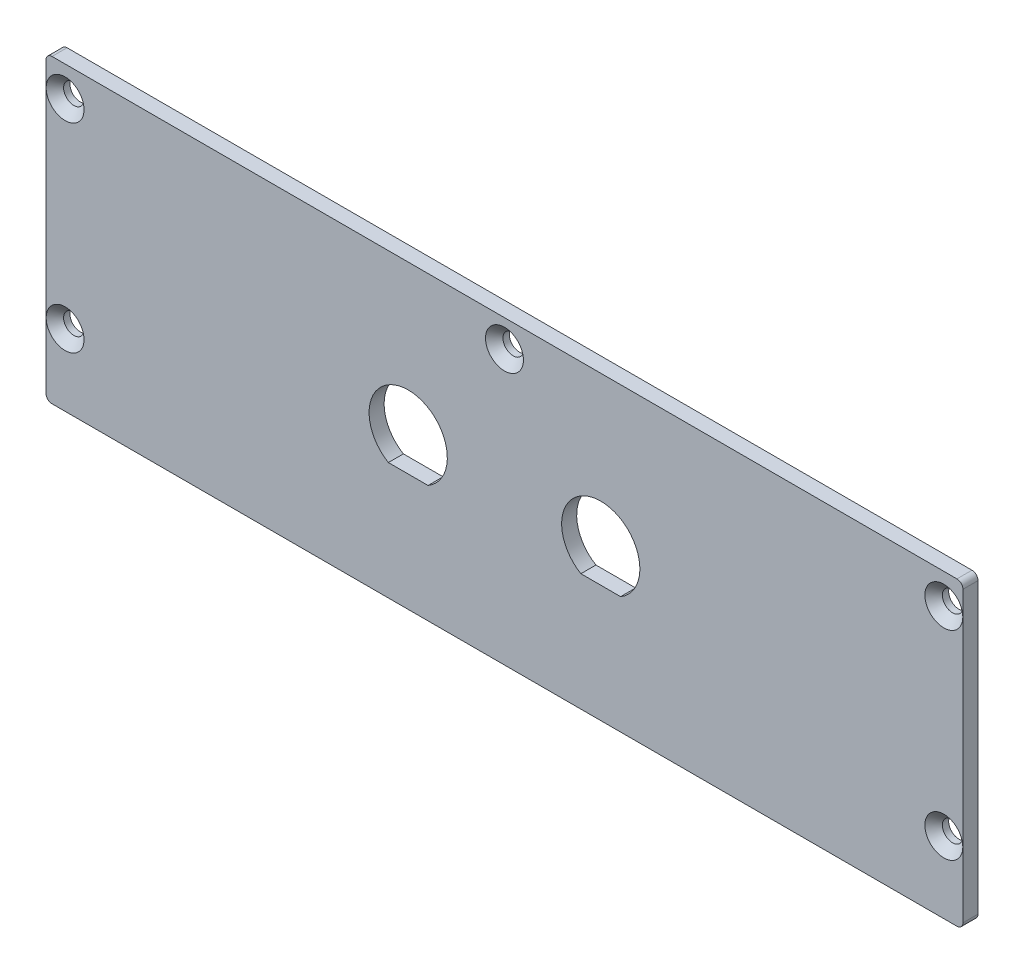
from build123d import *

# Parameters (mm, degrees)
BOSS_EXTRUDE1_DEPTH                          = 2.5
CSK_FOR_M3_COUNTERSUNK_FLAT_HEAD_SCR_2_COUNT = 2
CSK_FOR_M3_COUNTERSUNK_FLAT_HEAD_SCR_2_PITCH = 33.1
CSK_FOR_M3_COUNTERSUNK_FLAT_HEAD_SCR_3_COUNT = 2
CSK_FOR_M3_COUNTERSUNK_FLAT_HEAD_SCR_3_PITCH = 73.026544956
CSK_FOR_M3_COUNTERSUNK_FLAT_HEAD_SCR_4_COUNT = 2
CSK_FOR_M3_COUNTERSUNK_FLAT_HEAD_SCR_4_PITCH = 146.05
CSK_FOR_M3_COUNTERSUNK_FLAT_HEAD_SCR_5_COUNT = 2
CSK_FOR_M3_COUNTERSUNK_FLAT_HEAD_SCR_5_PITCH = 149.753839684
CUT_EXTRUDE1_DEPTH                           = 86.383473485


with BuildPart() as part:
    # Sketch2 → Boss-Extrude1 (new body)
    with BuildSketch(Plane.XY):
        with BuildLine():
            Line((-75.2, -11.559818622), (75.2, -11.559818622))
            ThreePointArc((75.2, -11.559818622), (75.907106781, -11.266925403), (76.2, -10.559818622))
            Line((76.2, -10.559818622), (76.2, 37.440181378))
            ThreePointArc((76.2, 37.440181378), (75.907106781, 38.147288159), (75.2, 38.440181378))
            Line((75.2, 38.440181378), (-75.2, 38.440181378))
            ThreePointArc((-75.2, 38.440181378), (-75.907106781, 38.147288159), (-76.2, 37.440181378))
            Line((-76.2, 37.440181378), (-76.2, -10.559818622))
            ThreePointArc((-76.2, -10.559818622), (-75.907106781, -11.266925403), (-75.2, -11.559818622))
        make_face()
    extrude(amount=BOSS_EXTRUDE1_DEPTH)

    # Sketch5 → CSK for M3 Countersunk Flat Head Screw1 (revolve, cut)
    with BuildSketch(Plane(origin=(-73.025, 33.440181378, 2.5), x_dir=(0, -1, 0), z_dir=(1, 0, 0))):
        Polygon((0, 0), (0, 2.5), (1.7, 2.5), (1.7, 1.45), (3.15, 0), align=None)
    csk_for_m3_countersunk_flat_head_screw1 = revolve(axis=Axis((-73.025, 33.440181378, 8.85), (0, 0, -1)), mode=Mode.SUBTRACT)

    # CSK for M3 Countersunk Flat Head Scr 2: CSK for M3 Countersunk Flat Head Screw1 ×2
    with Locations(*[(0, -i * CSK_FOR_M3_COUNTERSUNK_FLAT_HEAD_SCR_2_PITCH, 0) for i in range(1, CSK_FOR_M3_COUNTERSUNK_FLAT_HEAD_SCR_2_COUNT)]):
        add(csk_for_m3_countersunk_flat_head_screw1, mode=Mode.SUBTRACT)

    # CSK for M3 Countersunk Flat Head Scr 3: CSK for M3 Countersunk Flat Head Screw1 ×2
    with Locations(*[Vector(0.9999788439186126, 0.006504745590340633, 0) * (i * CSK_FOR_M3_COUNTERSUNK_FLAT_HEAD_SCR_3_PITCH) for i in range(1, CSK_FOR_M3_COUNTERSUNK_FLAT_HEAD_SCR_3_COUNT)]):
        add(csk_for_m3_countersunk_flat_head_screw1, mode=Mode.SUBTRACT)

    # CSK for M3 Countersunk Flat Head Scr 4: CSK for M3 Countersunk Flat Head Screw1 ×2
    with Locations(*[(i * CSK_FOR_M3_COUNTERSUNK_FLAT_HEAD_SCR_4_PITCH, 0, 0) for i in range(1, CSK_FOR_M3_COUNTERSUNK_FLAT_HEAD_SCR_4_COUNT)]):
        add(csk_for_m3_countersunk_flat_head_screw1, mode=Mode.SUBTRACT)

    # CSK for M3 Countersunk Flat Head Scr 5: CSK for M3 Countersunk Flat Head Screw1 ×2
    with Locations(*[Vector(0.9752671471296755, -0.22102939109888511, 0) * (i * CSK_FOR_M3_COUNTERSUNK_FLAT_HEAD_SCR_5_PITCH) for i in range(1, CSK_FOR_M3_COUNTERSUNK_FLAT_HEAD_SCR_5_COUNT)]):
        add(csk_for_m3_countersunk_flat_head_screw1, mode=Mode.SUBTRACT)

    # Sketch6 → Cut-Extrude1 (cut, through all)
    with BuildSketch(Plane.XY.offset(2.5)):
        with BuildLine():
            ThreePointArc((-12.7, 7.935569815), (-16, 20.035569815), (-19.3, 7.935569815))
            Line((-19.3, 7.935569815), (-12.7, 7.935569815))
        make_face()
        with BuildLine():
            ThreePointArc((19.3, 7.935569815), (16, 20.035569815), (12.7, 7.935569815))
            Line((12.7, 7.935569815), (19.3, 7.935569815))
        make_face()
    extrude(amount=-CUT_EXTRUDE1_DEPTH, mode=Mode.SUBTRACT)


solid = part.part
